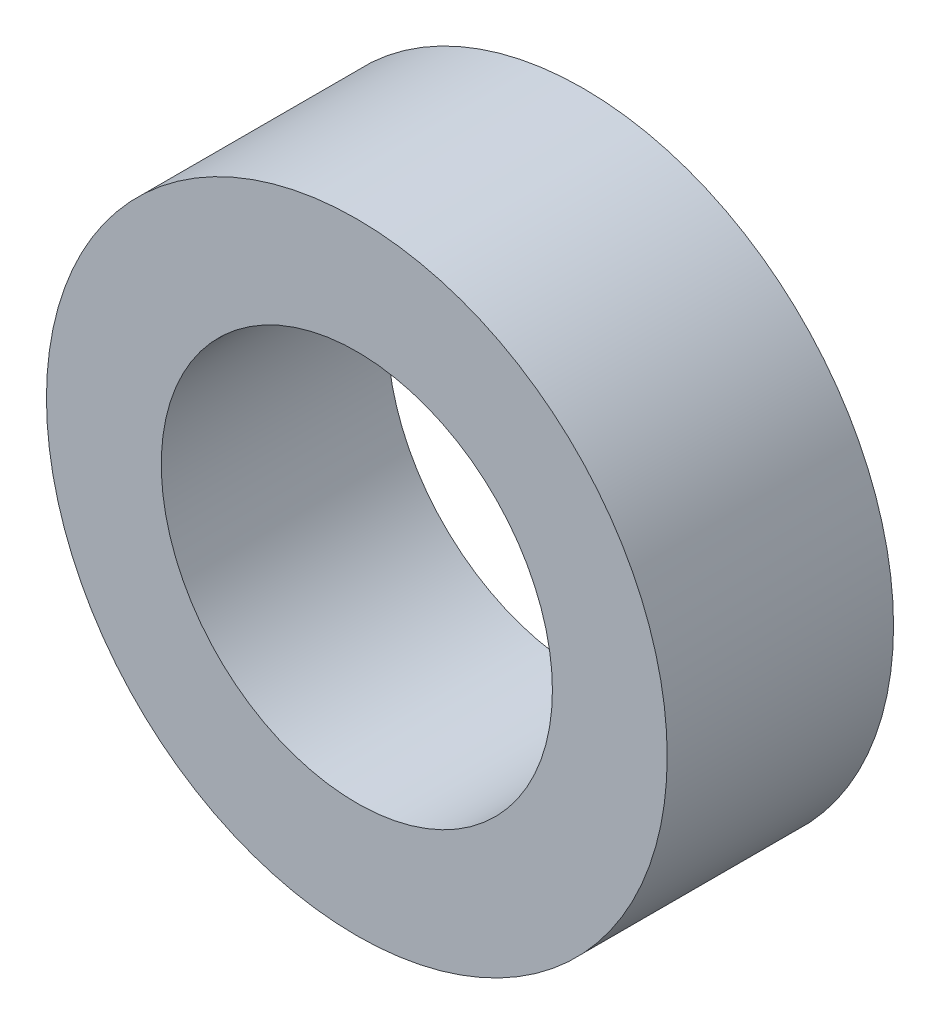
from build123d import *

# Parameters (mm, degrees)
SCHIZZO1_R                   = 4.745
SCHIZZO1_R_2                 = 2.99
ESTRUSIONE_ESTRUSIONE1_DEPTH = 3.46


with BuildPart() as part:
    # Schizzo1 → Estrusione-Estrusione1 (new body)
    with BuildSketch(Plane.XY):
        Circle(SCHIZZO1_R)
        Circle(SCHIZZO1_R_2, mode=Mode.SUBTRACT)
    extrude(amount=ESTRUSIONE_ESTRUSIONE1_DEPTH)


solid = part.part
